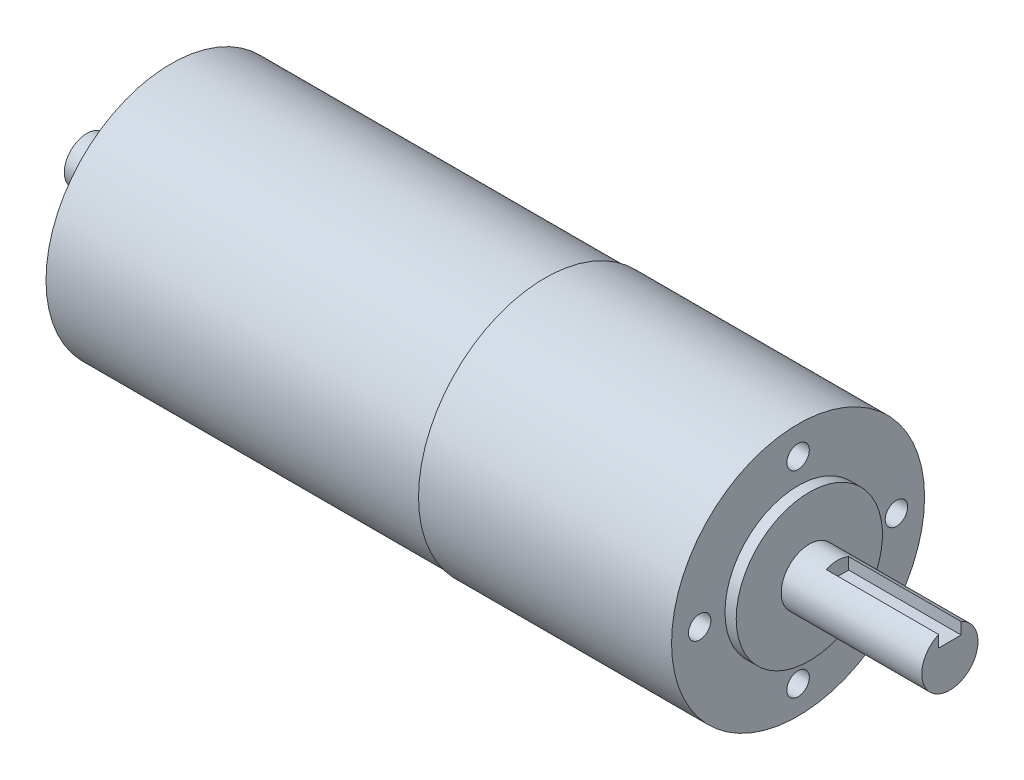
from build123d import *

# Parameters (mm, degrees)
SKETCH1_R           = 5
BOSS_EXTRUDE1_DEPTH = 25
SKETCH2_R           = 13
BOSS_EXTRUDE2_DEPTH = 2
SKETCH3_R           = 22.5
BOSS_EXTRUDE3_DEPTH = 45
SKETCH4_R           = 22.25
BOSS_EXTRUDE4_DEPTH = 66.5
SKETCH5_R           = 10
BOSS_EXTRUDE5_DEPTH = 5
SKETCH6_R           = 4
BOSS_EXTRUDE6_DEPTH = 10
SKETCH7_R           = 2
CUT_EXTRUDE1_DEPTH  = 9
SKETCH8_W           = 4
SKETCH8_H           = 2.5
CUT_EXTRUDE2_DEPTH  = 20


with BuildPart() as part:
    # Sketch1 → Boss-Extrude1 (new body)
    with BuildSketch(Plane(origin=(0, 0, 0), x_dir=(0, 0, -1), z_dir=(1, 0, 0))):
        Circle(SKETCH1_R)
    extrude(amount=-BOSS_EXTRUDE1_DEPTH)

    # Sketch2 → Boss-Extrude2 (add)
    with BuildSketch(Plane.ZY.offset(25)):
        Circle(SKETCH2_R)
    extrude(amount=BOSS_EXTRUDE2_DEPTH)

    # Sketch3 → Boss-Extrude3 (add)
    with BuildSketch(Plane.ZY.offset(27)):
        with Locations(Location((0, 0, 0), (0, 0, 180))):
            Circle(SKETCH3_R)
    extrude(amount=BOSS_EXTRUDE3_DEPTH)

    # Sketch4 → Boss-Extrude4 (add)
    with BuildSketch(Plane.ZY.offset(72)):
        Circle(SKETCH4_R)
    extrude(amount=BOSS_EXTRUDE4_DEPTH)

    # Sketch5 → Boss-Extrude5 (add)
    with BuildSketch(Plane.ZY.offset(138.5)):
        Circle(SKETCH5_R)
    extrude(amount=BOSS_EXTRUDE5_DEPTH)

    # Sketch6 → Boss-Extrude6 (add)
    with BuildSketch(Plane.ZY.offset(143.5)):
        Circle(SKETCH6_R)
    extrude(amount=BOSS_EXTRUDE6_DEPTH)

    # Sketch7 → Cut-Extrude1 (cut)
    with BuildSketch(Plane(origin=(-27, 0, 0), x_dir=(0, 0, -1), z_dir=(1, 0, 0))):
        with Locations((0, 17.5)):
            Circle(SKETCH7_R)
        with Locations((17.5, 0)):
            Circle(SKETCH7_R)
        with Locations((0, -17.5)):
            Circle(SKETCH7_R)
        with Locations((-17.5, 0)):
            Circle(SKETCH7_R)
    extrude(amount=-CUT_EXTRUDE1_DEPTH, mode=Mode.SUBTRACT)

    # Sketch8 → Cut-Extrude2 (cut)
    with BuildSketch(Plane(origin=(0, 0, 0), x_dir=(0, 0, -1), z_dir=(1, 0, 0))):
        with Locations((0, 3.75)):
            Rectangle(SKETCH8_W, SKETCH8_H)
    extrude(amount=-CUT_EXTRUDE2_DEPTH, mode=Mode.SUBTRACT)


solid = part.part
